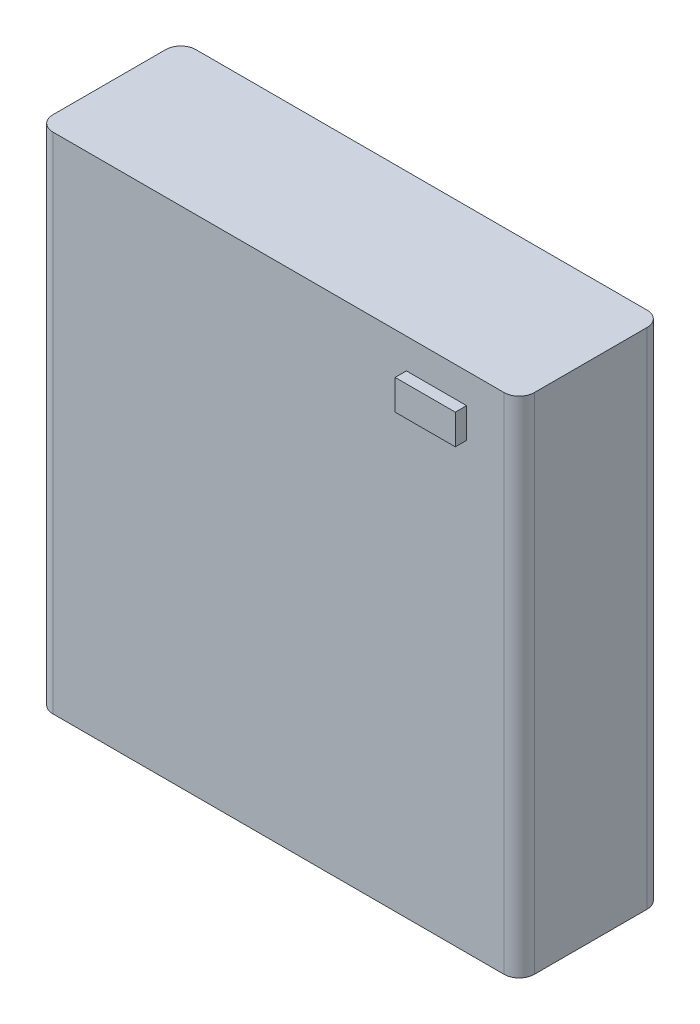
from build123d import *

# Parameters (mm, degrees)
SKETCH1_W           = 64
SKETCH1_H           = 67
BOSS_EXTRUDE1_DEPTH = 19
SKETCH2_W           = 8
SKETCH2_H           = 4
BOSS_EXTRUDE2_DEPTH = 1.5
FILLET1_R           = 2


with BuildPart() as part:
    # Sketch1 → Boss-Extrude1 (new body)
    with BuildSketch(Plane.XY):
        Rectangle(SKETCH1_W, SKETCH1_H)
    extrude(amount=BOSS_EXTRUDE1_DEPTH)

    # Sketch2 → Boss-Extrude2 (add)
    with BuildSketch(Plane.XY.offset(19)):
        with Locations((21, 27.5)):
            Rectangle(SKETCH2_W, SKETCH2_H)
    extrude(amount=BOSS_EXTRUDE2_DEPTH)

    # Fillet1
    fillet1_edges = [part.edges().sort_by_distance(p)[0] for p in [
        (32, 0, 19),
        (-32, 0, 19),
        (32, 0, 0),
        (-32, 0, 0),
    ]]
    fillet(fillet1_edges, radius=FILLET1_R)


solid = part.part
